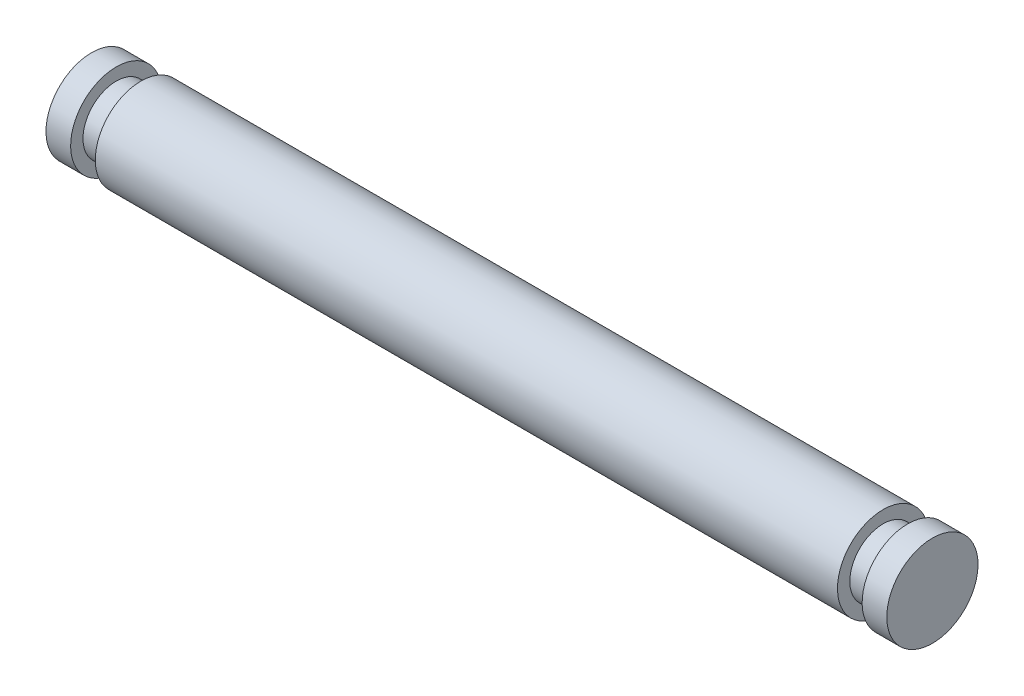
from build123d import *


with BuildPart() as part:
    # Sketch1 → Revolve1 (revolve)
    with BuildSketch(Plane.XY):
        Polygon((-30.1, 0), (30.1, 0), (30.1, -1), (32.1, -1), (32.1, 0), (34.1, 0), (34.1, -3.7), (-34.1, -3.7), (-34.1, 0), (-32.1, 0), (-32.1, -1), (-30.1, -1), align=None)
    revolve(axis=Axis((34.1, -3.7, 0), (-1, 0, 0)))


solid = part.part
